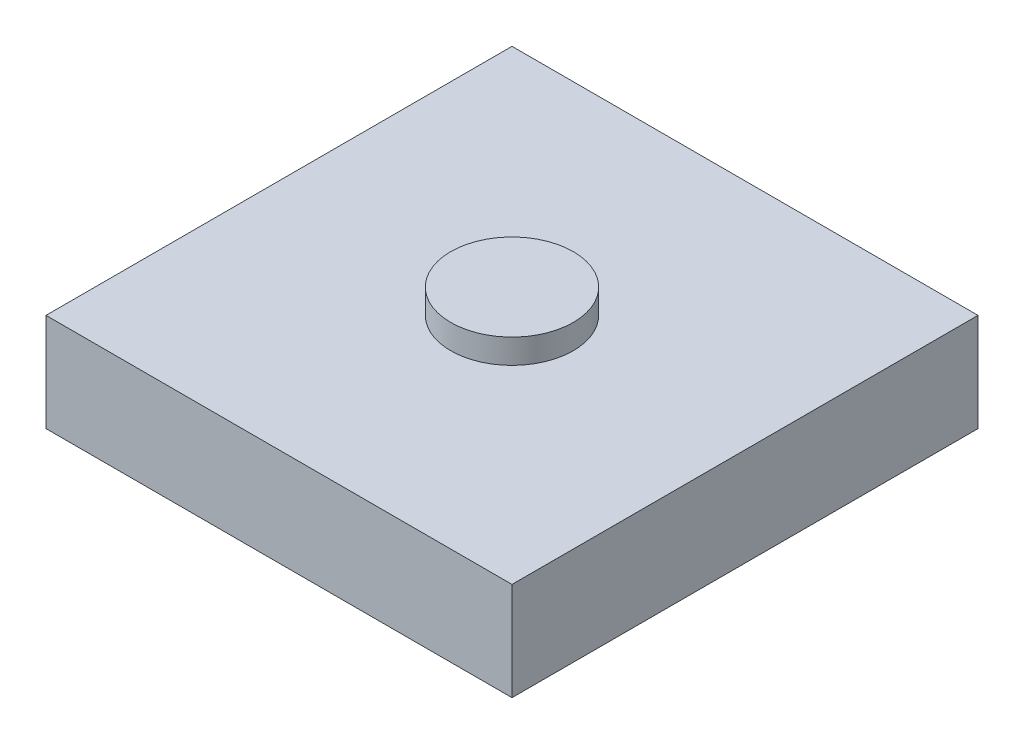
from build123d import *

# Parameters (mm, degrees)
SKETCH1_W           = 24.13
SKETCH1_H           = 24.13
BOSS_EXTRUDE1_DEPTH = 5.08
SKETCH2_R           = 3.302
CUT_EXTRUDE1_DEPTH  = 1.27
SKETCH3_R           = 3.175
BOSS_EXTRUDE2_DEPTH = 1.27


with BuildPart() as part:
    # Sketch1 → Boss-Extrude1 (new body)
    with BuildSketch(Plane(origin=(0, 0, 0), x_dir=(1, 0, 0), z_dir=(0, 1, 0))):
        Rectangle(SKETCH1_W, SKETCH1_H)
    extrude(amount=BOSS_EXTRUDE1_DEPTH)

    # Sketch2 → Cut-Extrude1 (cut)
    with BuildSketch(Plane(origin=(0, 0, 0), x_dir=(1, 0, 0), z_dir=(0, 1, 0))):
        with Locations(Location((0, 0, 0), (0, 0, 270))):
            Circle(SKETCH2_R)
    extrude(amount=CUT_EXTRUDE1_DEPTH, mode=Mode.SUBTRACT)

    # Sketch3 → Boss-Extrude2 (add)
    with BuildSketch(Plane(origin=(0, 5.08, 0), x_dir=(1, 0, 0), z_dir=(0, 1, 0))):
        with Locations(Location((0, 0, 0), (0, 0, 90))):
            Circle(SKETCH3_R)
    extrude(amount=BOSS_EXTRUDE2_DEPTH)


solid = part.part
